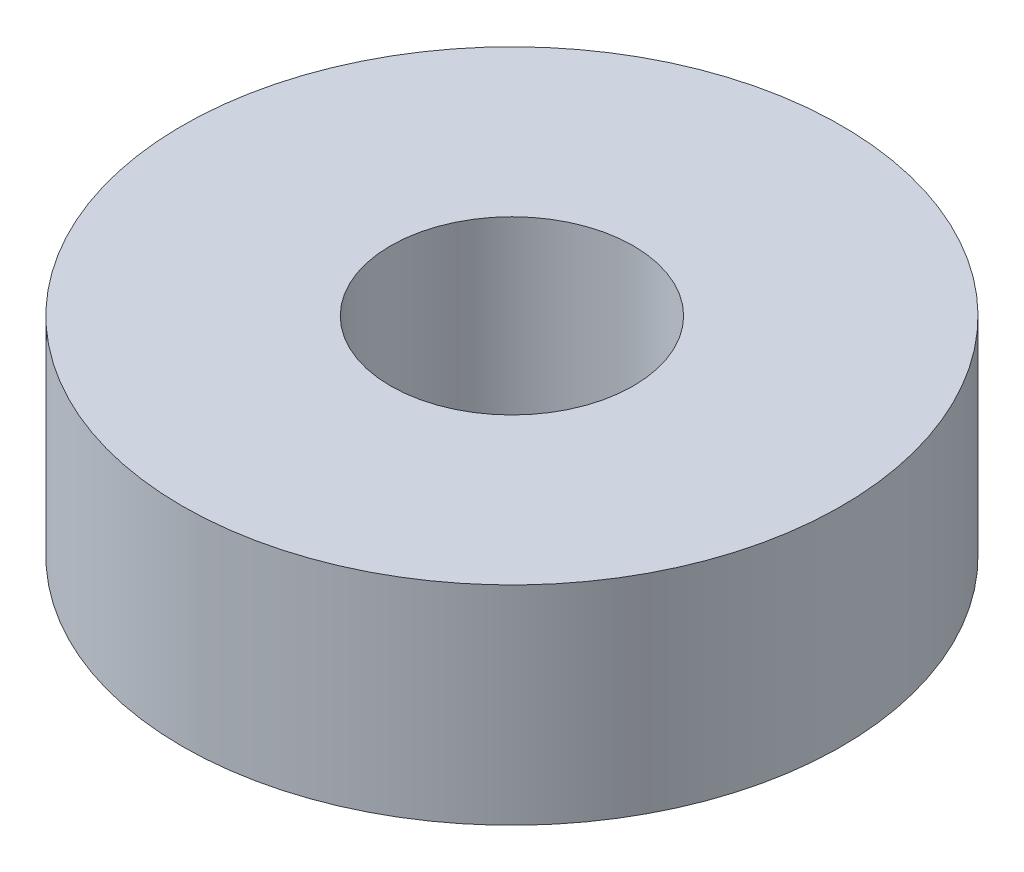
from build123d import *

# Parameters (mm, degrees)
SKETCH1_R           = 9.5
SKETCH1_R_2         = 3.5
BOSS_EXTRUDE1_DEPTH = 6


with BuildPart() as part:
    # Sketch1 → Boss-Extrude1 (new body)
    with BuildSketch(Plane(origin=(0, 0, 0), x_dir=(1, 0, 0), z_dir=(0, 1, 0))):
        with Locations(Location((0, 0, 0), (0, 0, 270))):
            Circle(SKETCH1_R)
        with Locations(Location((0, 0, 0), (0, 0, 270))):
            Circle(SKETCH1_R_2, mode=Mode.SUBTRACT)
    extrude(amount=BOSS_EXTRUDE1_DEPTH)


solid = part.part
